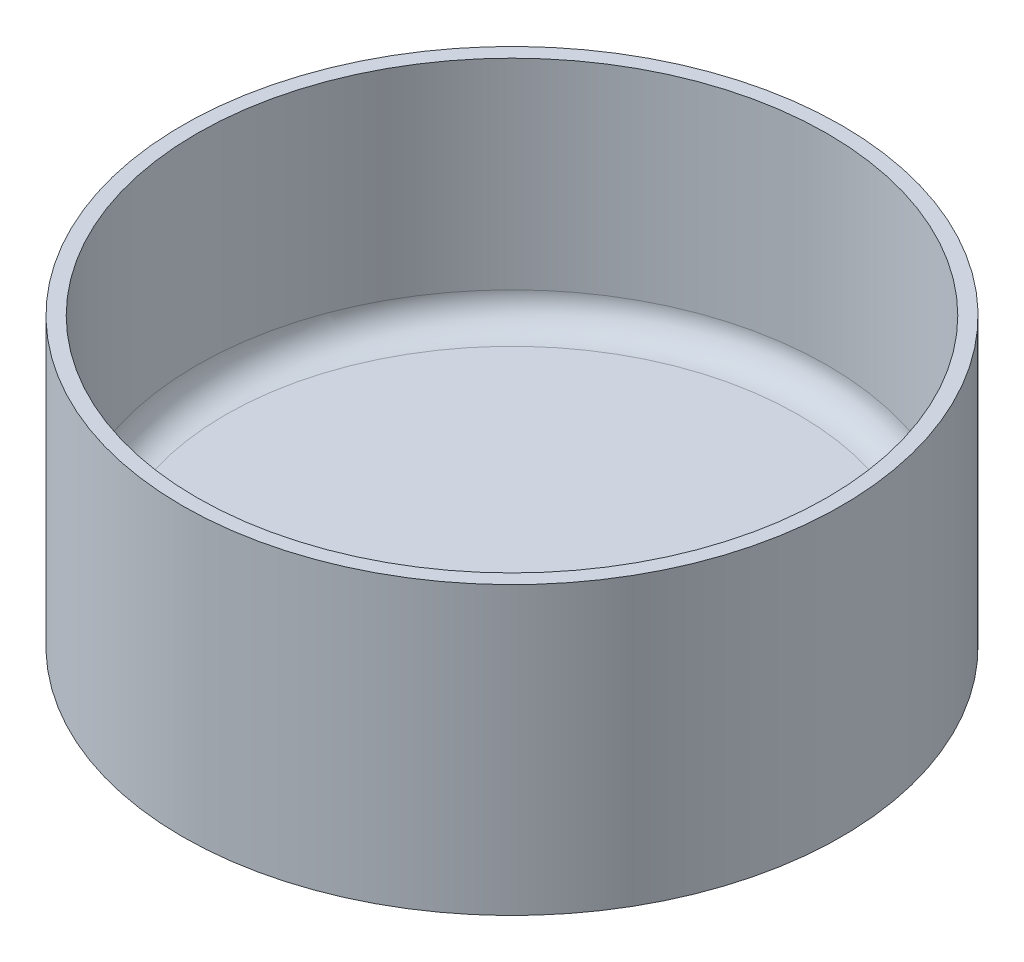
from build123d import *

# Parameters (mm, degrees)
SKETCH1_R           = 11.5
BOSS_EXTRUDE1_DEPTH = 10
SKETCH2_R           = 11
CUT_EXTRUDE1_DEPTH  = 8
FILLET1_R           = 1


with BuildPart() as part:
    # Sketch1 → Boss-Extrude1 (new body)
    with BuildSketch(Plane(origin=(0, 0, 0), x_dir=(1, 0, 0), z_dir=(0, 1, 0))):
        with Locations(Location((0, 0, 0), (0, 0, 270))):
            Circle(SKETCH1_R)
    extrude(amount=BOSS_EXTRUDE1_DEPTH)

    # Sketch2 → Cut-Extrude1 (cut)
    with BuildSketch(Plane(origin=(0, 10, 0), x_dir=(1, 0, 0), z_dir=(0, 1, 0))):
        with Locations(Location((0, 0, 0), (0, 0, 270))):
            Circle(SKETCH2_R)
    extrude(amount=-CUT_EXTRUDE1_DEPTH, mode=Mode.SUBTRACT)

    # Fillet1
    fillet1_edges = [part.edges().sort_by_distance(p)[0] for p in [
        (0, 2, -11),
    ]]
    fillet(fillet1_edges, radius=FILLET1_R)


solid = part.part
